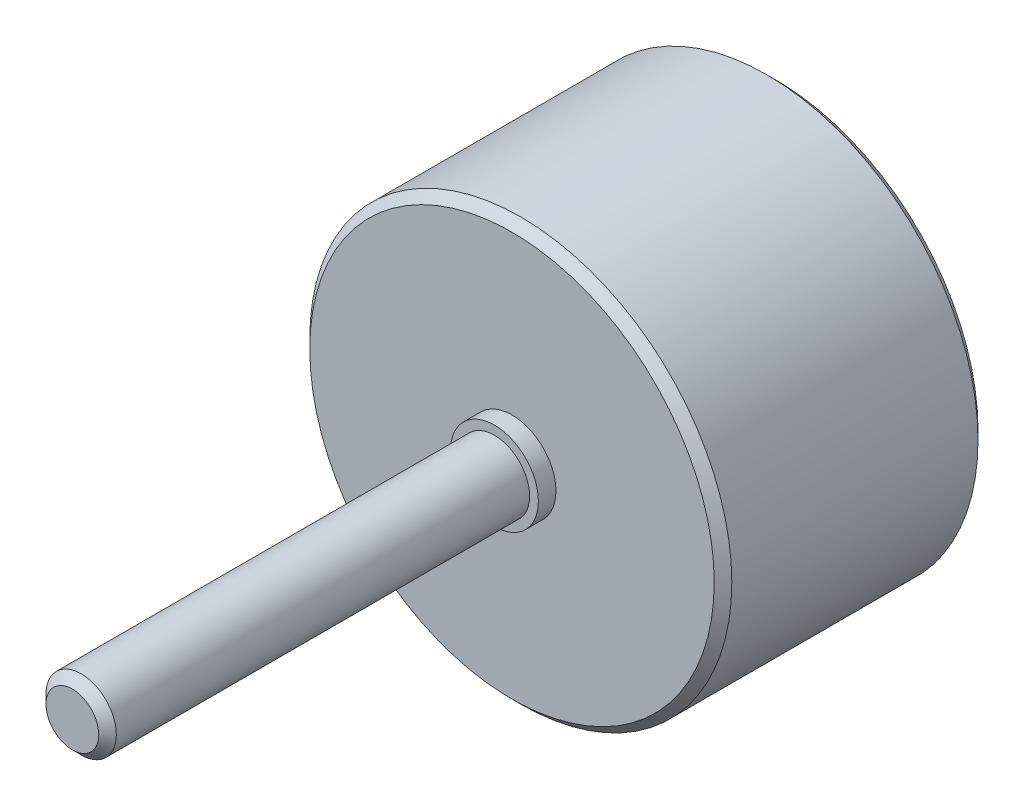
from build123d import *

# Parameters (mm, degrees)
ESQUISSE1_R             = 24
BOSS_EXTRU_1_DEPTH      = 30
ESQUISSE2_R             = 4
BOSS_EXTRU_2_DEPTH      = 50
ESQUISSE3_R             = 5
BOSS_EXTRU_3_DEPTH      = 2
ESQUISSE4_R             = 3
ENL_V_MAT_EXTRU_1_DEPTH = 10
CHANFREIN1_SIZE         = 1


with BuildPart() as part:
    # Esquisse1 → Boss.-Extru.1 (new body)
    with BuildSketch(Plane.XY):
        Circle(ESQUISSE1_R)
    extrude(amount=BOSS_EXTRU_1_DEPTH)

    # Esquisse2 → Boss.-Extru.2 (add)
    with BuildSketch(Plane.XY.offset(30)):
        Circle(ESQUISSE2_R)
    extrude(amount=BOSS_EXTRU_2_DEPTH)

    # Esquisse3 → Boss.-Extru.3 (add)
    with BuildSketch(Plane.XY.offset(30)):
        Circle(ESQUISSE3_R)
    extrude(amount=BOSS_EXTRU_3_DEPTH)

    # Esquisse4 → Enlèv. mat.-Extru.1 (cut)
    with BuildSketch(Plane(origin=(0, 0, 0), x_dir=(-1, 0, 0), z_dir=(0, 0, -1))):
        Circle(ESQUISSE4_R)
    extrude(amount=-ENL_V_MAT_EXTRU_1_DEPTH, mode=Mode.SUBTRACT)

    # Chanfrein1
    chanfrein1_edges = [part.edges().sort_by_distance(p)[0] for p in [
        (-24, 0, 0),
        (-24, 0, 30),
        (-4, 0, 80),
    ]]
    chamfer(chanfrein1_edges, length=CHANFREIN1_SIZE)


solid = part.part
